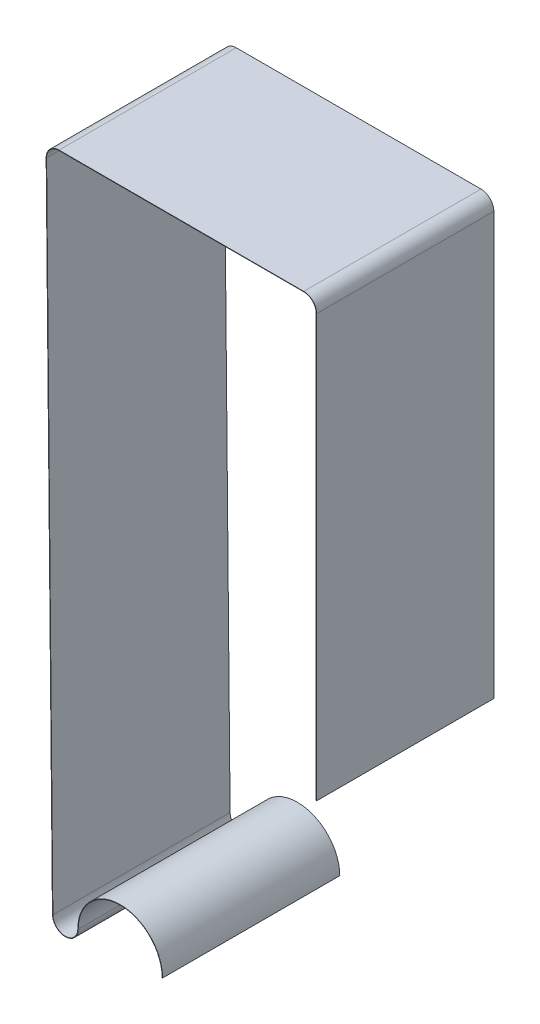
from build123d import *

# Parameters (mm, degrees)
SKETCH2_W = 0.5
SKETCH2_H = 210


with BuildPart() as part:
    # Sweep1: sweep along a path in Sketch1
    with BuildLine(Plane.XY) as sweep1_path:
        Line((5, 1131.07306524), (5, 1631.07306524))
        ThreePointArc((5, 1631.07306524), (0.606601718, 1641.679666958), (-10, 1646.07306524))
        Line((-10, 1646.07306524), (-300, 1646.07306524))
        ThreePointArc((-300, 1646.07306524), (-310.657609176, 1641.628413015), (-314.99930284, 1630.928447459))
        Line((-314.99930284, 1630.928447459), (-307.545742915, 857.868578543))
        ThreePointArc((-307.545742915, 857.868578543), (-292.474130344, 843.013370614), (-277.546440075, 858.013196323))
        ThreePointArc((-277.546440075, 858.013196323), (-227.546440075, 908.013196323), (-177.546440075, 858.013196323))
    # Sketch2 → Sweep1 (sweep)
    with BuildSketch(Plane(origin=(0, 1131.07306524, 0), x_dir=(1, 0, 0), z_dir=(0, 1, 0))):
        with Locations((5, 0)):
            Rectangle(SKETCH2_W, SKETCH2_H)
    sweep(path=sweep1_path.line)


solid = part.part
